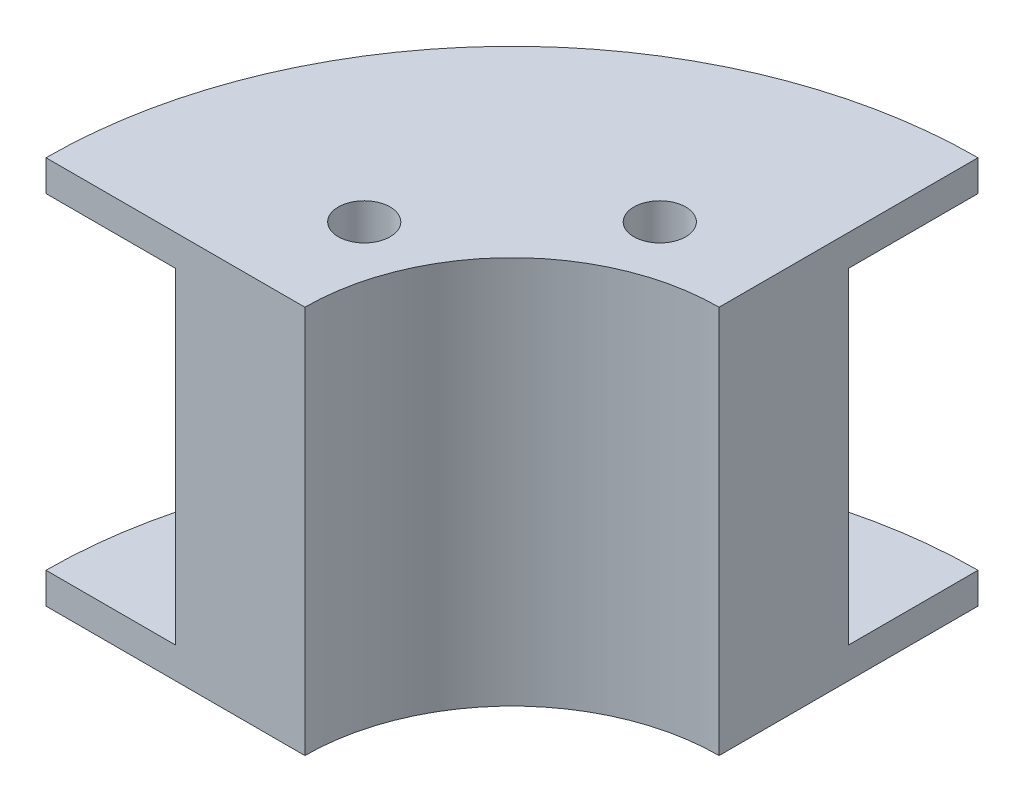
from build123d import *

# Parameters (mm, degrees)
REVOLVE_1_ANGLE     = 90
SKETCH_2_R          = 1
CUT_EXTRUDE_1_DEPTH = 27.795522014


with BuildPart() as part:
    # 草图1 → 旋转1 (revolve)
    with BuildSketch(Plane.XY):
        Polygon((-5, 7.5), (5, 7.5), (5, -7.5), (-5, -7.5), (-5, -6.3), (0, -6.3), (0, 6.3), (-5, 6.3), align=None)
    revolve(axis=Axis((13, 23.403849413, 0), (0, -1, 0)), revolution_arc=REVOLVE_1_ANGLE)

    # 草图2 → 切除-拉伸1 (cut, through all)
    with BuildSketch(Plane.XZ.offset(7.5)):
        with Locations((3.291756081, -4)):
            Circle(SKETCH_2_R)
        with Locations((9, -9.708243919)):
            Circle(SKETCH_2_R)
    extrude(amount=-CUT_EXTRUDE_1_DEPTH, mode=Mode.SUBTRACT)


solid = part.part
